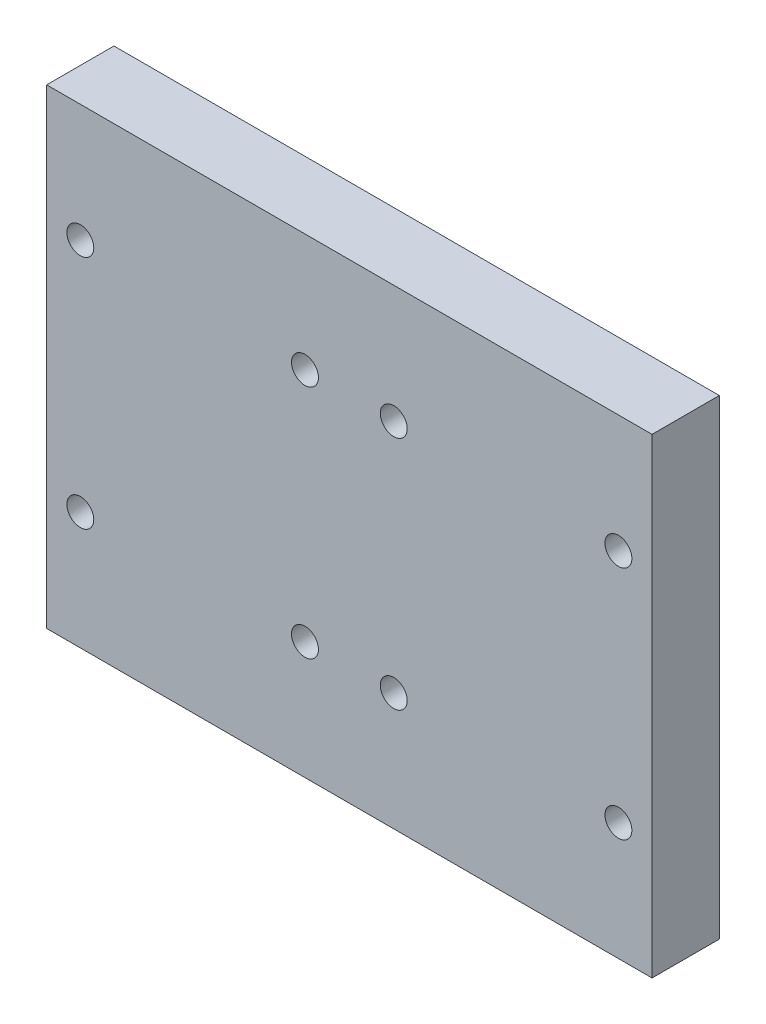
from build123d import *

# Parameters (mm, degrees)
ESQUISSE1_W         = 86
ESQUISSE1_H         = 70
ESQUISSE1_R         = 2
BOSS_EXTRU_1_DEPTH  = 10
SKETCH1_W           = 2
SKETCH1_H           = 70
BOSS_EXTRUDE2_DEPTH = 10


with BuildPart() as part:
    # Esquisse1 → Boss.-Extru.1 (new body)
    with BuildSketch(Plane.XY):
        with Locations((43, -35)):
            Rectangle(ESQUISSE1_W, ESQUISSE1_H)
        with Locations((3, -17.5)):
            Circle(ESQUISSE1_R, mode=Mode.SUBTRACT)
        with Locations((3, -52.5)):
            Circle(ESQUISSE1_R, mode=Mode.SUBTRACT)
        with Locations((36.4, -52.5)):
            Circle(ESQUISSE1_R, mode=Mode.SUBTRACT)
        with Locations((36.4, -17.5)):
            Circle(ESQUISSE1_R, mode=Mode.SUBTRACT)
        with Locations(Location((49.6, -52.5, 0), (0, 0, 180))):
            Circle(ESQUISSE1_R, mode=Mode.SUBTRACT)
        with Locations(Location((83, -52.5, 0), (0, 0, 180))):
            Circle(ESQUISSE1_R, mode=Mode.SUBTRACT)
        with Locations(Location((83, -17.5, 0), (0, 0, 180))):
            Circle(ESQUISSE1_R, mode=Mode.SUBTRACT)
        with Locations(Location((49.6, -17.5, 0), (0, 0, 180))):
            Circle(ESQUISSE1_R, mode=Mode.SUBTRACT)
    extrude(amount=BOSS_EXTRU_1_DEPTH)

    # Sketch1 → Boss-Extrude2 (add)
    with BuildSketch(Plane(origin=(0, 0, 0), x_dir=(-1, 0, 0), z_dir=(0, 0, -1))):
        with Locations((1, -35)):
            Rectangle(SKETCH1_W, SKETCH1_H)
        with Locations((-87, -35)):
            Rectangle(SKETCH1_W, SKETCH1_H)
    extrude(amount=-BOSS_EXTRUDE2_DEPTH)


solid = part.part
